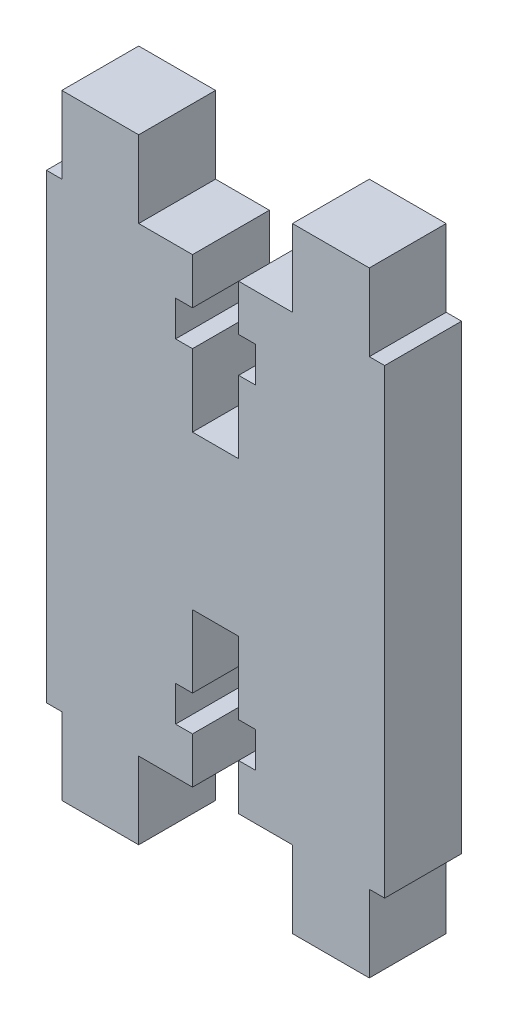
from build123d import *

# Parameters (mm, degrees)
BOSS_EXTRUDE1_DEPTH = 5


with BuildPart() as part:
    # Sketch1 → Boss-Extrude1 (new body)
    with BuildSketch(Plane.XY):
        Polygon((0, 30), (1, 30), (1, 35), (6, 35), (6, 30), (9.5, 30), (9.5, 27), (8.4, 27), (8.4, 24.7), (9.5, 24.7), (9.5, 20), (12.5, 20), (12.5, 24.7), (13.6, 24.7), (13.6, 27), (12.5, 27), (12.5, 30), (16, 30), (16, 35), (21, 35), (21, 30), (22, 30), (22, 0), (21, 0), (21, -5), (16, -5), (16, 0), (12.5, 0), (12.5, 3), (13.6, 3), (13.6, 5.3), (12.5, 5.3), (12.5, 10), (9.5, 10), (9.5, 5.3), (8.4, 5.3), (8.4, 3), (9.5, 3), (9.5, 0), (6, 0), (6, -5), (1, -5), (1, 0), (0, 0), align=None)
    extrude(amount=BOSS_EXTRUDE1_DEPTH)


solid = part.part
